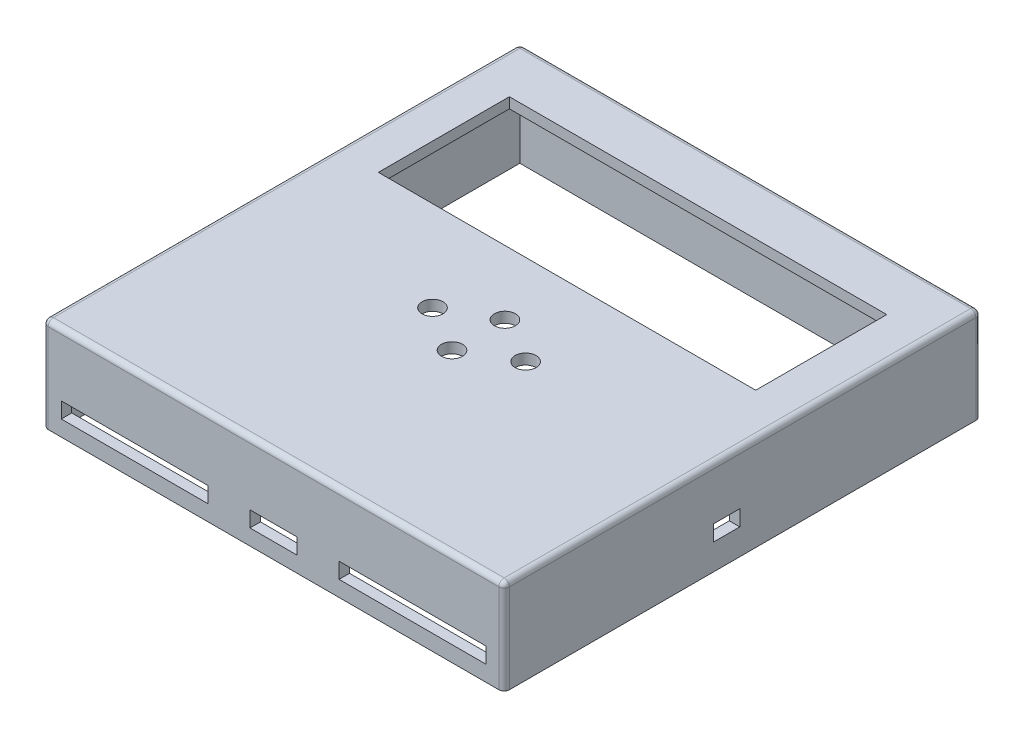
from build123d import *

# Parameters (mm, degrees)
SKETCH1_W           = 88
SKETCH1_H           = 91
BOSS_EXTRUDE1_DEPTH = 18
SHELL1_T            = -2
FILLET1_R           = 1
SKETCH2_R           = 2
SKETCH2_W           = 72
SKETCH2_H           = 25
CUT_EXTRUDE1_DEPTH  = 18
CUT_EXTRUDE2_REACH  = 107.256
SKETCH3_W           = 28
SKETCH3_H           = 3
SKETCH3_W_2         = 9
CUT_EXTRUDE3_REACH  = 104.367
SKETCH4_W           = 5
SKETCH4_H           = 3


with BuildPart() as part:
    # Sketch1 → Boss-Extrude1 (new body)
    with BuildSketch(Plane(origin=(0, 0, 0), x_dir=(1, 0, 0), z_dir=(0, 1, 0))):
        with Locations((-5.737068998, 3.601045098)):
            Rectangle(SKETCH1_W, SKETCH1_H)
    extrude(amount=BOSS_EXTRUDE1_DEPTH)

    # Shell1
    shell1_openings = [part.faces().sort_by_distance(p)[0] for p in [
        (-5.737068998, 0, -3.601045098),
    ]]
    offset(amount=SHELL1_T, openings=shell1_openings, kind=Kind.INTERSECTION)

    # Fillet1
    fillet1_edges = [part.edges().sort_by_distance(p)[0] for p in [
        (38.262931002, 18, -3.601045098),
        (-5.737068998, 18, -49.101045098),
        (-49.737068998, 18, -3.601045098),
        (-49.737068998, 0, -3.601045098),
        (-5.737068998, 18, 41.898954902),
        (-49.737068998, 9, -49.101045098),
        (38.262931002, 9, -49.101045098),
        (38.262931002, 9, 41.898954902),
        (-49.737068998, 9, 41.898954902),
    ]]
    fillet(fillet1_edges, radius=FILLET1_R)

    # Sketch2 → Cut-Extrude1 (cut)
    with BuildSketch(Plane(origin=(0, 18, 0), x_dir=(1, 0, 0), z_dir=(0, 1, 0))):
        with Locations(Location((-5.30968118, 1.818409631, 0), (0, 0, 270))):
            Circle(SKETCH2_R)
        with Locations(Location((-5.30968118, -8.274923211, 0), (0, 0, 270))):
            Circle(SKETCH2_R)
        with Locations(Location((-14.188721584, -3.11442221, 0), (0, 0, 270))):
            Circle(SKETCH2_R)
        with Locations(Location((3.569359225, -3.11442221, 0), (0, 0, 270))):
            Circle(SKETCH2_R)
        with Locations((-5.737068998, 26.601045098)):
            Rectangle(SKETCH2_W, SKETCH2_H)
    extrude(amount=-CUT_EXTRUDE1_DEPTH, mode=Mode.SUBTRACT)

    # Sketch3 → Cut-Extrude2 (cut, up to next)
    with BuildSketch(Plane.XY.offset(41.898954902), mode=Mode.PRIVATE) as cut_extrude2_sk1:
        with Locations((-32.237068998, 4.495374911)):
            Rectangle(SKETCH3_W, SKETCH3_H)
    cut_extrude2_tool1 = extrude(cut_extrude2_sk1.sketch, amount=-CUT_EXTRUDE2_REACH, mode=Mode.PRIVATE) & part.part
    # Sketch3 → Cut-Extrude2 (cut, up to next)
    with BuildSketch(Plane.XY.offset(41.898954902), mode=Mode.PRIVATE) as cut_extrude2_sk2:
        with Locations((20.762931002, 4.495374911)):
            Rectangle(SKETCH3_W, SKETCH3_H)
    cut_extrude2_tool2 = extrude(cut_extrude2_sk2.sketch, amount=-CUT_EXTRUDE2_REACH, mode=Mode.PRIVATE) & part.part
    # Sketch3 → Cut-Extrude2 (cut, up to next)
    with BuildSketch(Plane.XY.offset(41.898954902), mode=Mode.PRIVATE) as cut_extrude2_sk3:
        with Locations((-5.737068998, 4.495374911)):
            Rectangle(SKETCH3_W_2, SKETCH3_H)
    cut_extrude2_tool3 = extrude(cut_extrude2_sk3.sketch, amount=-CUT_EXTRUDE2_REACH, mode=Mode.PRIVATE) & part.part
    add(cut_extrude2_tool1.solids().sort_by_distance((-32.237069, 4.495375, 41.898955))[0], mode=Mode.SUBTRACT)
    add(cut_extrude2_tool2.solids().sort_by_distance((20.762931, 4.495375, 41.898955))[0], mode=Mode.SUBTRACT)
    add(cut_extrude2_tool3.solids().sort_by_distance((-5.737069, 4.495375, 41.898955))[0], mode=Mode.SUBTRACT)

    # Sketch4 → Cut-Extrude3 (cut, up to next)
    with BuildSketch(Plane(origin=(38.262931002, 0, 0), x_dir=(0, 0, -1), z_dir=(1, 0, 0)), mode=Mode.PRIVATE) as cut_extrude3_sk1:
        with Locations((0.5597151, 6.442773973)):
            Rectangle(SKETCH4_W, SKETCH4_H)
    cut_extrude3_tool1 = extrude(cut_extrude3_sk1.sketch, amount=-CUT_EXTRUDE3_REACH, mode=Mode.PRIVATE) & part.part
    add(cut_extrude3_tool1.solids().sort_by_distance((38.262931, 6.442774, -0.559715))[0], mode=Mode.SUBTRACT)


solid = part.part
